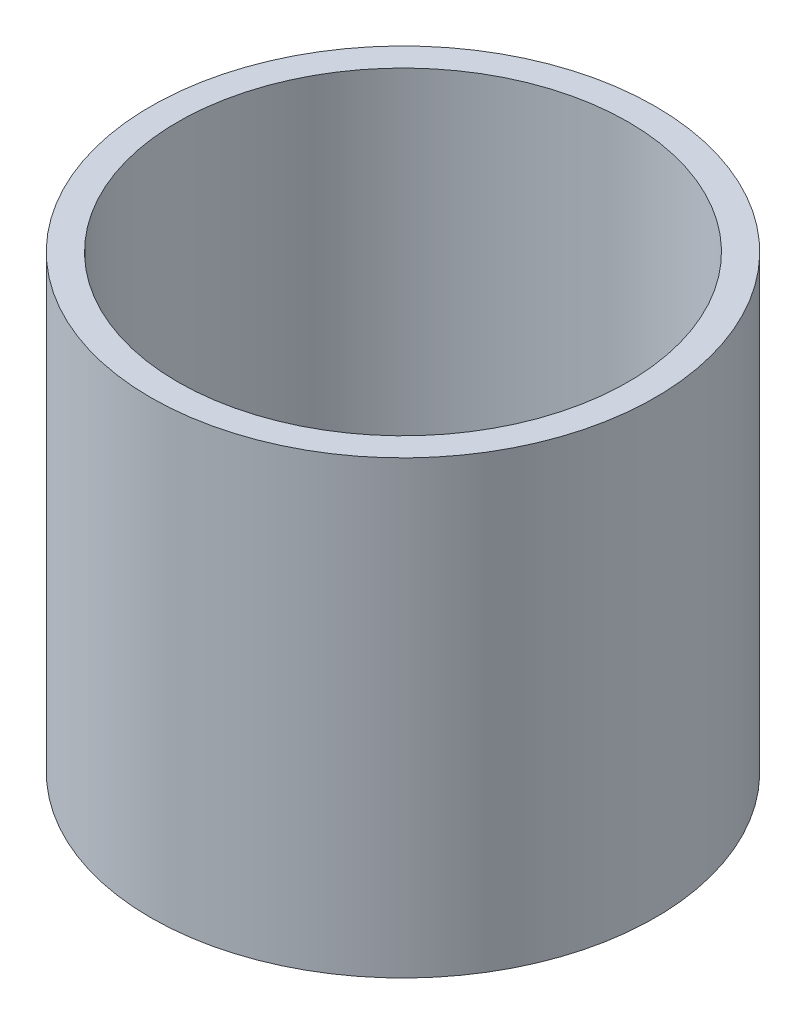
from build123d import *

# Parameters (mm, degrees)
SKETCH1_R           = 2.8
SKETCH1_R_2         = 2.5
BOSS_EXTRUDE1_DEPTH = 5


with BuildPart() as part:
    # Sketch1 → Boss-Extrude1 (new body)
    with BuildSketch(Plane(origin=(0, 0, 0), x_dir=(1, 0, 0), z_dir=(0, 1, 0))):
        with Locations(Location((0, 0, 0), (0, 0, 270))):
            Circle(SKETCH1_R)
        with Locations(Location((0, 0, 0), (0, 0, 270))):
            Circle(SKETCH1_R_2, mode=Mode.SUBTRACT)
    extrude(amount=BOSS_EXTRUDE1_DEPTH)


solid = part.part
